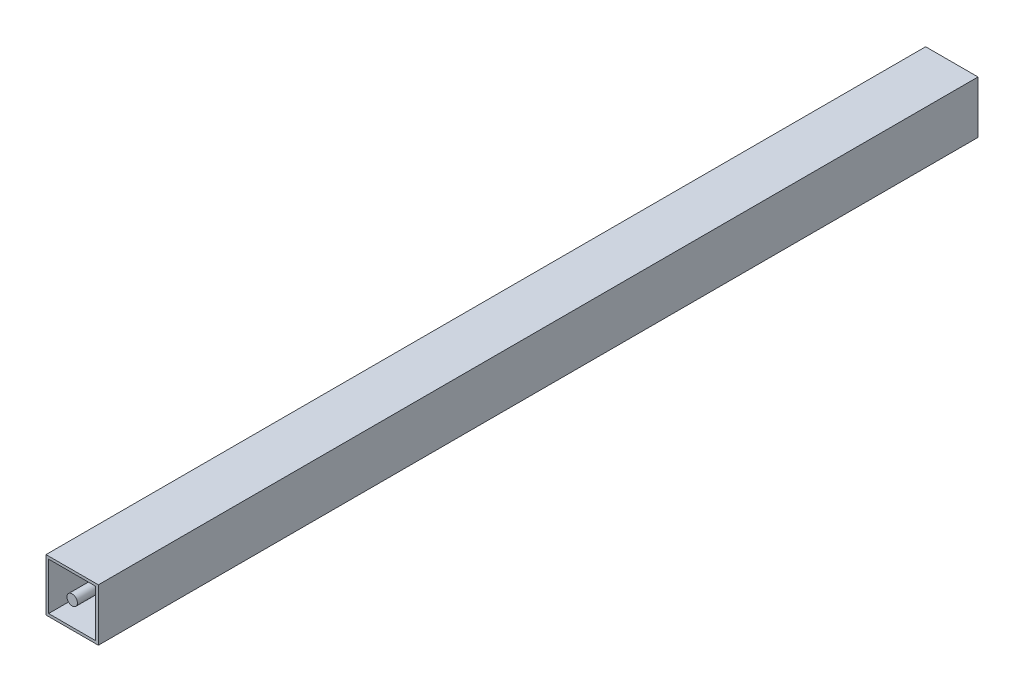
from build123d import *

# Parameters (mm, degrees)
SKETCH1_W             = 10
SKETCH1_H             = 10
SKETCH1_W_2           = 9
SKETCH1_H_2           = 9
BOSS_EXTRUDE1_DEPTH   = 168
SKETCH1_R             = 1
BOSS_EXTRUDE1_2_DEPTH = 168


with BuildPart() as part:
    # Sketch1 → Boss-Extrude1 (new body)
    with BuildSketch(Plane.XY):
        with Locations((4.5, 4.5)):
            Rectangle(SKETCH1_W, SKETCH1_H)
        with Locations((4.5, 4.5)):
            Rectangle(SKETCH1_W_2, SKETCH1_H_2, mode=Mode.SUBTRACT)
    extrude(amount=BOSS_EXTRUDE1_DEPTH)


with BuildPart() as body_2:
    # Sketch1 → Boss-Extrude1 2 (new body)
    with BuildSketch(Plane.XY):
        with Locations(Location((4.5, 4.5, 0), (0, 0, 180))):
            Circle(SKETCH1_R)
    extrude(amount=BOSS_EXTRUDE1_2_DEPTH)


solid = Compound([part.part, body_2.part])
